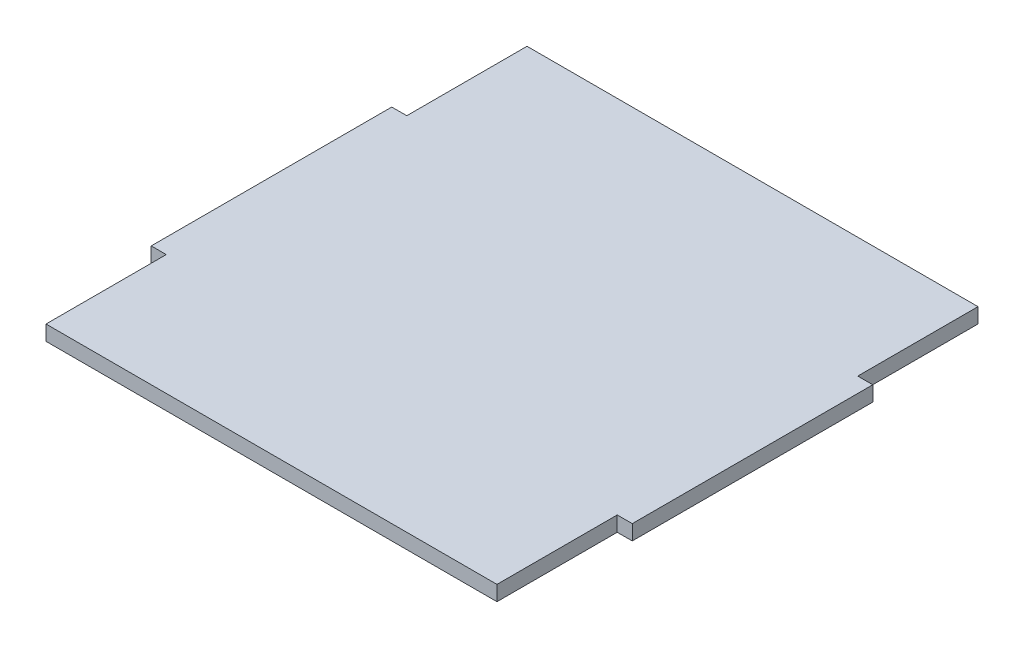
from build123d import *

# Parameters (mm, degrees)
BOSS_EXTRUDE1_DEPTH = 3.175


with BuildPart() as part:
    # Sketch1 → Boss-Extrude1 (new body)
    with BuildSketch(Plane(origin=(0, 0, 0), x_dir=(1, 0, 0), z_dir=(0, 1, 0))):
        Polygon((3.175, 101.6), (3.175, 76.2), (0, 76.2), (0, 25.4), (3.175, 25.4), (3.175, 0), (98.425, 0), (98.425, 25.4), (101.6, 25.4), (101.6, 76.2), (98.425, 76.2), (98.425, 101.6), align=None)
    extrude(amount=BOSS_EXTRUDE1_DEPTH)


solid = part.part
